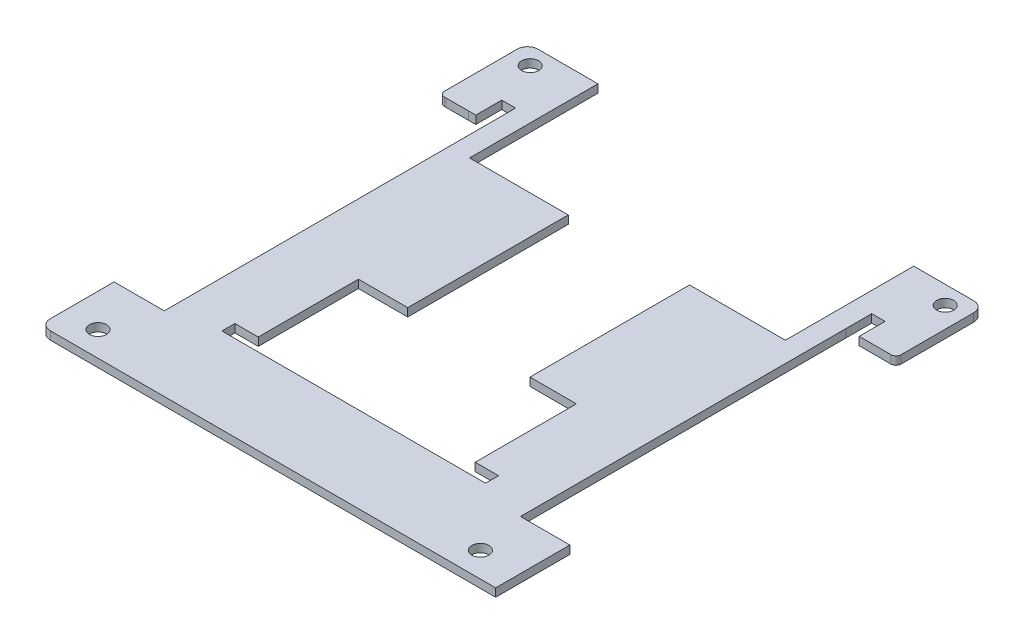
from build123d import *

# Parameters (mm, degrees)
SKETCH1_2_R                 = 1.6383
BOSS_EXTRUDE2_DEPTH         = 1.575
SKETCH2_W                   = 14.080651801
SKETCH2_H                   = 7.11628052
SKETCH2_W_2                 = 15.007196354
SKETCH2_H_2                 = 9.421332762
CUT_EXTRUDE1_DEPTH          = 65.400942629
ADDITIONAL_PCB_MATERIAL_W   = 2.649520344
ADDITIONAL_PCB_MATERIAL_H   = 65.213315835
ADDITIONAL_PCB_MATERIAL_W_2 = 1.5
ADDITIONAL_PCB_MATERIAL_H_2 = 65.299191064
BOSS_EXTRUDE3_DEPTH         = 1.575
SKETCH3_W                   = 46.818
SKETCH3_H                   = 1
BOSS_EXTRUDE4_DEPTH         = 1.575
SKETCH4_W                   = 2
SKETCH4_H                   = 2.5
CUT_EXTRUDE2_DEPTH          = 65.400942629
SKETCH5_W                   = 2.5
SKETCH5_H                   = 18.09999695
SKETCH5_H_2                 = 19.499999394
BOSS_EXTRUDE5_DEPTH         = 1.575
SKETCH7_W                   = 9.5
SKETCH7_H                   = 1.20600305
CUT_EXTRUDE3_DEPTH          = 65.400942629
SKETCH26_W                  = 2.575
SKETCH26_H                  = 5
CUT_EXTRUDE4_DEPTH          = 10


with BuildPart() as part:
    # Sketch1<2> → Boss-Extrude2 (new body)
    with BuildSketch(Plane(origin=(0, 0, 0), x_dir=(1, 0, 0), z_dir=(0, 1, 0))):
        with BuildLine():
            Line((-38.39500299, 29.999999735), (-42.73000299, 29.999999735))
            Line((-42.73000299, 29.999999735), (-43.011025994, 30.003097626))
            ThreePointArc((-43.011025994, 30.003097626), (-43.710996344, 30.299838092), (-44.000003042, 31.003036872))
            Line((-44.000003042, 31.003036872), (-44.000003042, 31.269999735))
            Line((-44.000003042, 31.269999735), (-44.000005679, 44.999999735))
            ThreePointArc((-44.000005679, 44.999999735), (-43.414218633, 46.414215608), (-42.000002924, 47.000003051))
            Line((-42.000002924, 47.000003051), (-30.435003, 47.000003051))
            Line((-30.435003, 47.000003051), (-30.435003, 22.255357341))
            Line((-30.435003, 22.255357341), (-11.409003, 22.255357341))
            Line((-11.409003, 22.255357341), (-11.409003, -9.899999999))
            Line((-11.409003, -9.899999999), (-23.409003, -9.899999999))
            Line((-23.409003, -9.899999999), (-23.409003, -31.499996949))
            Line((-23.409003, -31.499996949), (23.408997, -31.499996949))
            Line((23.408997, -31.499996949), (23.408997, -8.499997555))
            Line((23.408997, -8.499997555), (11.97084713, -8.499997555))
            Line((11.97084713, -8.499997555), (11.97084713, 22.255357341))
            Line((11.97084713, 22.255357341), (30.434997, 22.255357341))
            Line((30.434997, 22.255357341), (30.434997, 47.000003051))
            Line((30.434997, 47.000003051), (42.000008541, 47.000003051))
            ThreePointArc((42.000008541, 47.000003051), (43.414213215, 46.414220704), (43.999996956, 45.000016607))
            Line((43.999996956, 45.000016607), (43.999996956, 32.000003378))
            Line((43.999996956, 32.000003378), (43.999996956, 31.015615364))
            ThreePointArc((43.999996956, 31.015615364), (43.706534093, 30.307939396), (42.998386406, 30.015616661))
            Line((42.998386406, 30.015616661), (33.825607551, 30.030389905))
            ThreePointArc((33.825607551, 30.030389905), (33.117459864, 29.738067169), (32.823997, 29.030391202))
            Line((32.823997, 29.030391202), (32.823997, -30.453996949))
            ThreePointArc((32.823997, -30.453996949), (33.116890219, -31.16110373), (33.823997, -31.453996949))
            Line((33.823997, -31.453996949), (36.099999555, -31.453996949))
            Line((36.099999555, -31.453996949), (42.849728118, -31.453996949))
            ThreePointArc((42.849728118, -31.453996949), (43.556834899, -31.746890168), (43.849728118, -32.453996949))
            Line((43.849728118, -32.453996949), (43.849728118, -36.999996949))
            Line((43.849728118, -36.999996949), (43.849728118, -46.999996949))
            Line((43.849728118, -46.999996949), (-42.000000178, -46.999996949))
            ThreePointArc((-42.000000178, -46.999996949), (-43.414212804, -46.414211581), (-44.000000499, -44.999999921))
            Line((-44.000000499, -44.999999921), (-44.000000178, -38.976999921))
            Line((-44.000000178, -38.976999921), (-44.000000178, -32.453999802))
            ThreePointArc((-44.000000178, -32.453999802), (-43.70710696, -31.746893021), (-43.000000178, -31.453999802))
            Line((-43.000000178, -31.453999802), (-36.100000549, -31.453999802))
            Line((-36.100000549, -31.453999802), (-33.824003042, -31.453999802))
            ThreePointArc((-33.824003042, -31.453999802), (-33.116896261, -31.161106583), (-32.824003042, -30.453999802))
            Line((-32.824003042, -30.453999802), (-32.824003042, 29.011483943))
            ThreePointArc((-32.824003042, 29.011483943), (-33.117785331, 29.719478678), (-33.826516131, 30.011480785))
            Line((-33.826516131, 30.011480785), (-38.39500299, 29.999999735))
        make_face()
        with Locations((40, 43.5)):
            Circle(SKETCH1_2_R, mode=Mode.SUBTRACT)
        with Locations((-40, 43.5)):
            Circle(SKETCH1_2_R, mode=Mode.SUBTRACT)
        with Locations((-37.6, -42.2)):
            Circle(SKETCH1_2_R, mode=Mode.SUBTRACT)
        with Locations((36.1, -42.2)):
            Circle(SKETCH1_2_R, mode=Mode.SUBTRACT)
    extrude(amount=BOSS_EXTRUDE2_DEPTH)

    # Sketch2 → Cut-Extrude1 (cut, through all)
    with BuildSketch(Plane(origin=(0, 1.575, 0), x_dir=(1, 0, 0), z_dir=(0, 1, 0))):
        with Locations((39.863054019, -29.135856689)):
            Rectangle(SKETCH2_W, SKETCH2_H)
        with Locations((-40.336598676, -27.983330568)):
            Rectangle(SKETCH2_W_2, SKETCH2_H_2)
    extrude(amount=-CUT_EXTRUDE1_DEPTH, mode=Mode.SUBTRACT)

    # Additional PCB material → Boss-Extrude3 (add)
    with BuildSketch(Plane(origin=(0, 1.575, 0), x_dir=(1, 0, 0), z_dir=(0, 1, 0))):
        with Locations((32.999236828, -1.128517583)):
            Rectangle(ADDITIONAL_PCB_MATERIAL_W, ADDITIONAL_PCB_MATERIAL_H)
        with Locations((-33.574003042, -1.085579968)):
            Rectangle(ADDITIONAL_PCB_MATERIAL_W_2, ADDITIONAL_PCB_MATERIAL_H_2)
    extrude(amount=-BOSS_EXTRUDE3_DEPTH)

    # Sketch3 → Boss-Extrude4 (add)
    with BuildSketch(Plane(origin=(0, 1.575, 0), x_dir=(1, 0, 0), z_dir=(0, 1, 0))):
        with Locations((-3e-06, -30.999996949)):
            Rectangle(SKETCH3_W, SKETCH3_H)
    extrude(amount=-BOSS_EXTRUDE4_DEPTH)

    # Sketch4 → Cut-Extrude2 (cut, through all)
    with BuildSketch(Plane(origin=(0, 1.575, 0), x_dir=(1, 0, 0), z_dir=(0, 1, 0))):
        with Locations((24.408997, -29.249996949)):
            Rectangle(SKETCH4_W, SKETCH4_H)
        with Locations((-24.409003, -29.249996949)):
            Rectangle(SKETCH4_W, SKETCH4_H)
    extrude(amount=-CUT_EXTRUDE2_DEPTH, mode=Mode.SUBTRACT)

    # Sketch5 → Boss-Extrude5 (add)
    with BuildSketch(Plane(origin=(0, 1.575, 0), x_dir=(1, 0, 0), z_dir=(0, 1, 0))):
        with Locations((-22.159003, -18.949998474)):
            Rectangle(SKETCH5_W, SKETCH5_H)
        with Locations((22.158997, -18.249997252)):
            Rectangle(SKETCH5_W, SKETCH5_H_2)
    extrude(amount=-BOSS_EXTRUDE5_DEPTH)

    # Sketch7 → Cut-Extrude3 (cut, through all)
    with BuildSketch(Plane(origin=(0, 1.575, 0), x_dir=(1, 0, 0), z_dir=(0, 1, 0))):
        with Locations((-16.159003, -9.296998474)):
            Rectangle(SKETCH7_W, SKETCH7_H)
    extrude(amount=-CUT_EXTRUDE3_DEPTH, mode=Mode.SUBTRACT)

    # Sketch26 → Cut-Extrude4 (cut)
    with BuildSketch(Plane(origin=(0, 1.575, 0), x_dir=(1, 0, 0), z_dir=(0, 1, 0))):
        Polygon((-36.984003042, 35.010230552), (-34.324003042, 35.010230552), (-34.324003042, 29.927765717), (-36.984003042, 29.927765717), (-36.984003042, 30.010230552), align=None)
        with Locations((35.612496956, 32.515616661)):
            Rectangle(SKETCH26_W, SKETCH26_H)
    extrude(amount=-CUT_EXTRUDE4_DEPTH, mode=Mode.SUBTRACT)


solid = part.part
